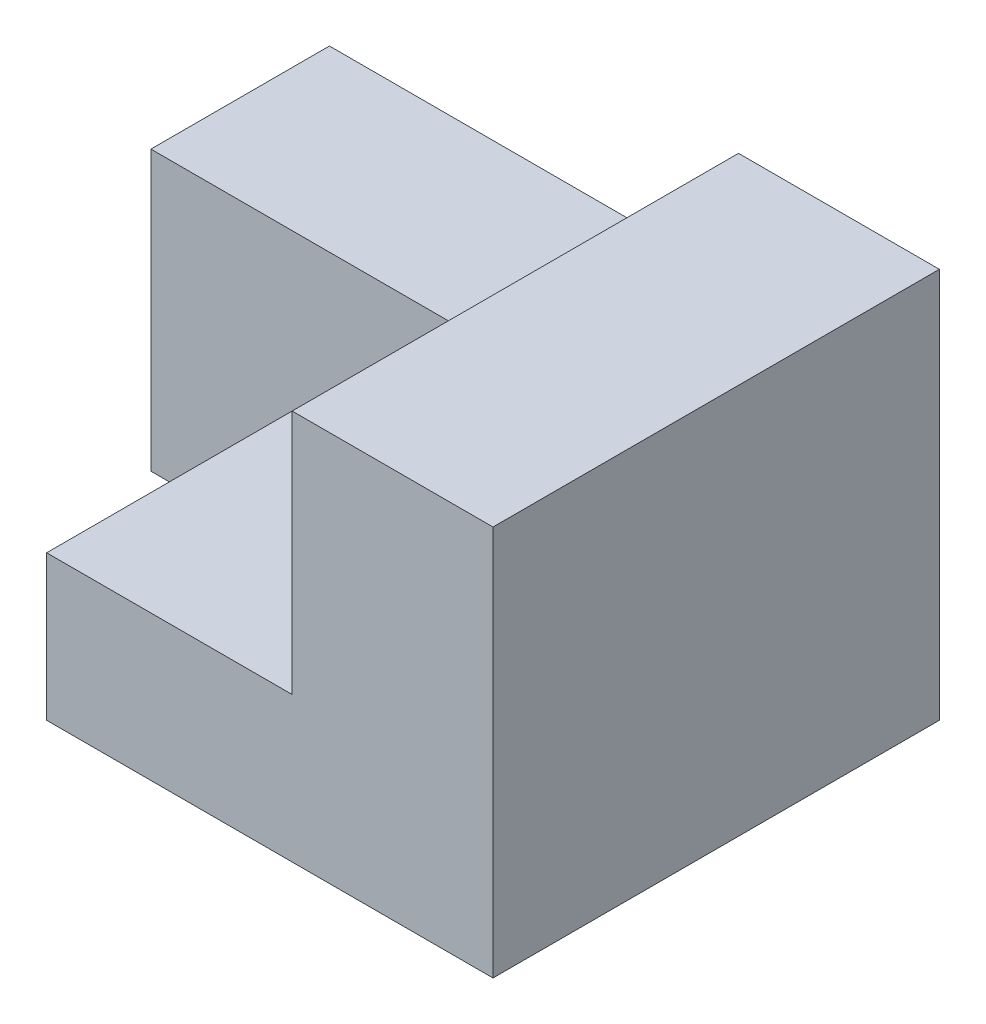
from build123d import *

# Parameters (mm, degrees)
BOSS_EXTRUDE1_DEPTH = 40
BOSS_EXTRUDE2_DEPTH = 16


with BuildPart() as part:
    # Sketch1 → Boss-Extrude1 (new body)
    with BuildSketch(Plane.XY):
        Polygon((0, 0), (0, 35), (-18, 35), (-18, 13), (-40, 13), (-40, 0), align=None)
    extrude(amount=-BOSS_EXTRUDE1_DEPTH)

    # Sketch2 → Boss-Extrude2 (add)
    with BuildSketch(Plane(origin=(0, 0, -40), x_dir=(-1, 0, 0), z_dir=(0, 0, -1))):
        Polygon((18, 13), (18, 25), (54.657821702, 25), (54.657821702, 0), (40, 0), (40, 13), align=None)
    extrude(amount=-BOSS_EXTRUDE2_DEPTH)


solid = part.part
